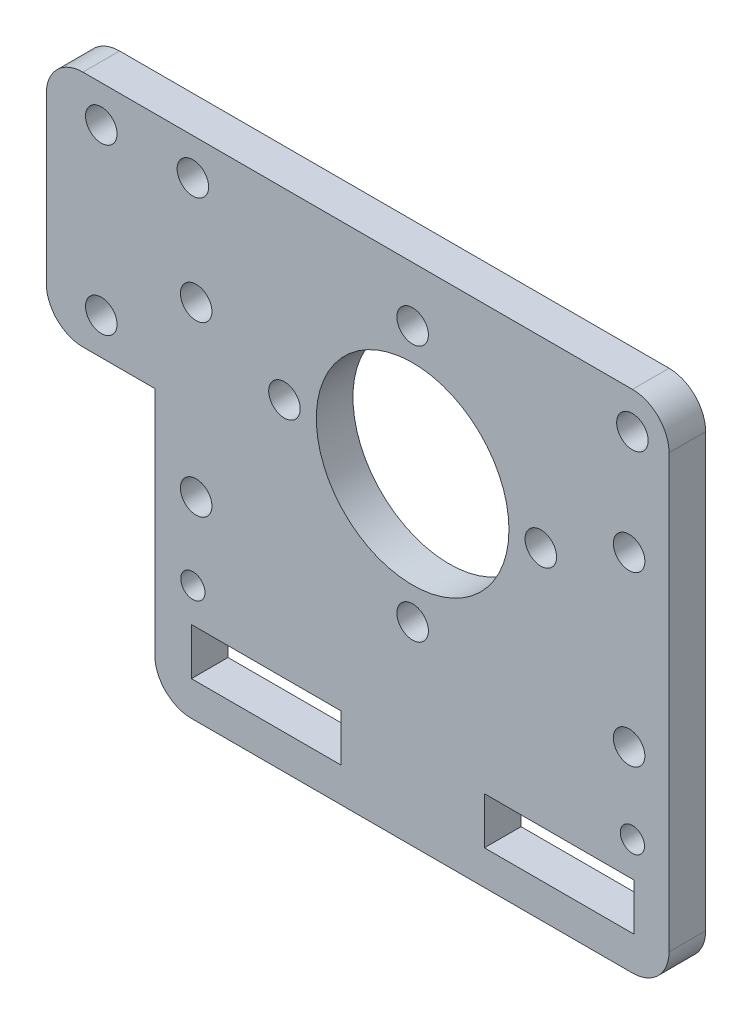
from build123d import *

# Parameters (mm, degrees)
SKETCH_1_W          = 70
SKETCH_1_H          = 69
SKETCH_1_R          = 1.65
SKETCH_1_W_2        = 20.4
SKETCH_1_H_2        = 6.4
SKETCH_1_R_2        = 2.15
SKETCH_1_R_3        = 13.15
SKETCH_1_W_3        = 15
EXTRUDE_1_DEPTH     = 5
SKETCH_2_W          = 14.8
SKETCH_2_H          = 36.5
CUT_EXTRUDE_1_DEPTH = 67.790717918
FILLET_1_R          = 5


with BuildPart() as part:
    # ｽｹｯﾁ1 → ﾎﾞｽ - 押し出し1 (new body)
    # profile 1 of 2: a face of its own
    with BuildSketch(Plane.XY):
        with Locations((0, -9.5)):
            Rectangle(SKETCH_1_W, SKETCH_1_H)
        with Locations((-30, -28.2)):
            Circle(SKETCH_1_R, mode=Mode.SUBTRACT)
        with Locations((-20, -36.1)):
            Rectangle(SKETCH_1_W_2, SKETCH_1_H_2, mode=Mode.SUBTRACT)
        with Locations((-29.55, -17.5)):
            Circle(SKETCH_1_R_2, mode=Mode.SUBTRACT)
        with Locations((20, -36.1)):
            Rectangle(SKETCH_1_W_2, SKETCH_1_H_2, mode=Mode.SUBTRACT)
        with Locations((30, -28.2)):
            Circle(SKETCH_1_R, mode=Mode.SUBTRACT)
        with Locations((0, -17.5)):
            Circle(SKETCH_1_R_2, mode=Mode.SUBTRACT)
        with Locations((29.55, -17.5)):
            Circle(SKETCH_1_R_2, mode=Mode.SUBTRACT)
        with Locations((-29.55, 5.5)):
            Circle(SKETCH_1_R_2, mode=Mode.SUBTRACT)
        with Locations((-17.5, 0)):
            Circle(SKETCH_1_R_2, mode=Mode.SUBTRACT)
        with Locations((-30, 20)):
            Circle(SKETCH_1_R_2, mode=Mode.SUBTRACT)
        Circle(SKETCH_1_R_3, mode=Mode.SUBTRACT)
        with Locations((17.5, 0)):
            Circle(SKETCH_1_R_2, mode=Mode.SUBTRACT)
        with Locations((29.55, 5.5)):
            Circle(SKETCH_1_R_2, mode=Mode.SUBTRACT)
        with Locations((0, 17.5)):
            Circle(SKETCH_1_R_2, mode=Mode.SUBTRACT)
        with Locations((30, 20)):
            Circle(SKETCH_1_R_2, mode=Mode.SUBTRACT)
    # profile 2 of 2: a face of its own
    with BuildSketch(Plane.XY):
        with Locations((-42.5, -9.5)):
            Rectangle(SKETCH_1_W_3, SKETCH_1_H)
        with Locations((-42.5, -2.5)):
            Circle(SKETCH_1_R_2, mode=Mode.SUBTRACT)
        with Locations((-42.5, 20)):
            Circle(SKETCH_1_R_2, mode=Mode.SUBTRACT)
    extrude(amount=EXTRUDE_1_DEPTH)

    # ｽｹｯﾁ2 → ｶｯﾄ - 押し出し1 (cut, through all)
    with BuildSketch(Plane.XY.offset(5)):
        with Locations((-42.6, -25.75)):
            Rectangle(SKETCH_2_W, SKETCH_2_H)
    extrude(amount=-CUT_EXTRUDE_1_DEPTH, mode=Mode.SUBTRACT)

    # ﾌｨﾚｯﾄ1
    fillet_1_edges = [part.edges().sort_by_distance(p)[0] for p in [
        (-50, 25, 2.5),
        (35, 25, 2.5),
        (35, -44, 2.5),
        (-50, -7.5, 2.5),
        (-35.2, -44, 2.5),
    ]]
    fillet(fillet_1_edges, radius=FILLET_1_R)


solid = part.part
